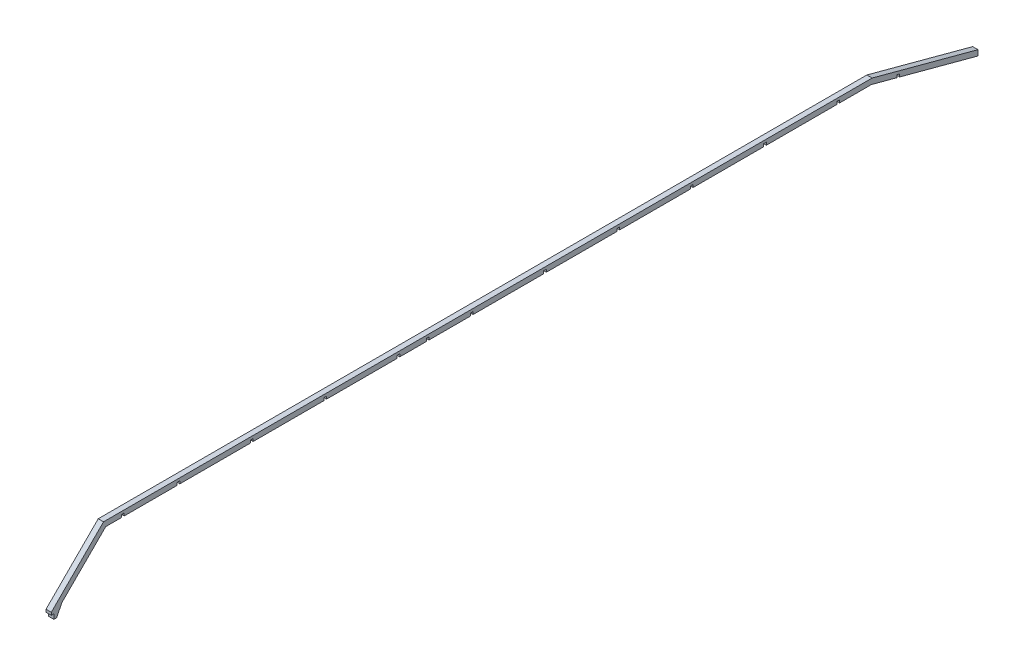
from build123d import *

# Parameters (mm, degrees)
EXTRUDE_3_DEPTH = 6


with BuildPart() as part:
    # Эскиз1 → Бобышка-Вытянуть3 (new body)
    with BuildSketch(Plane(origin=(0, 0, 0), x_dir=(0, 0, -1), z_dir=(1, 0, 0))):
        Polygon((-751.886625415, -19.142158624), (-733.960587786, -19.142158624), (-733.960587786, -16.142158624), (-730.960587786, -16.142158624), (-730.960587786, -19.142158624), (-670.960587786, -19.142158624), (-670.960587786, -16.142158624), (-667.960587786, -16.142158624), (-667.960587786, -19.142158624), (-587.960587786, -19.142158624), (-587.960587786, -16.142158624), (-584.960587786, -16.142158624), (-584.960587786, -19.142158624), (-504.960587786, -19.142158624), (-504.960587786, -16.142158624), (-501.960587786, -16.142158624), (-501.960587786, -19.142158624), (-421.960587786, -19.142158624), (-421.960587786, -16.142158624), (-418.960587786, -16.142158624), (-418.960587786, -19.142158624), (-388.960587786, -19.142158624), (-388.960587786, -16.142158624), (-385.960587786, -16.142158624), (-385.960587786, -19.142158624), (-338.960587786, -19.142158624), (-338.960587786, -16.142158624), (-335.960587786, -16.142158624), (-335.960587786, -19.142158624), (-255.960587786, -19.142158624), (-255.960587786, -16.142158624), (-252.960587786, -16.142158624), (-252.960587786, -19.142158624), (-172.960587786, -19.142158624), (-172.960587786, -16.142158624), (-169.960587786, -16.142158624), (-169.960587786, -19.142158624), (-89.960587786, -19.142158624), (-89.960587786, -16.142158624), (-86.960587786, -16.142158624), (-86.960587786, -19.142158624), (-6.960587786, -19.142158624), (-6.960587786, -16.142158624), (-3.960587786, -16.142158624), (-3.960587786, -19.142158624), (76.039412214, -19.142158624), (76.039412214, -16.142158624), (79.039412214, -16.142158624), (79.039412214, -19.142158624), (115.173374585, -19.142158624), (144.039412214, -26.876790095), (144.039412214, -23.876790095), (147.039412214, -24.680637672), (147.039412214, -27.680637672), (235.790250936, -51.461353235), (235.790250936, -45.249696153), (115.963289571, -13.142158624), (-754.371906789, -13.142158624), (-813.525123531, -72.295375365), (-813.525123531, -75.295375365), (-810.525123531, -75.295375365), (-810.525123531, -80.78065674), (-807.525123531, -80.78065674), (-801.525123531, -68.78065674), align=None)
    extrude(amount=EXTRUDE_3_DEPTH)


solid = part.part
